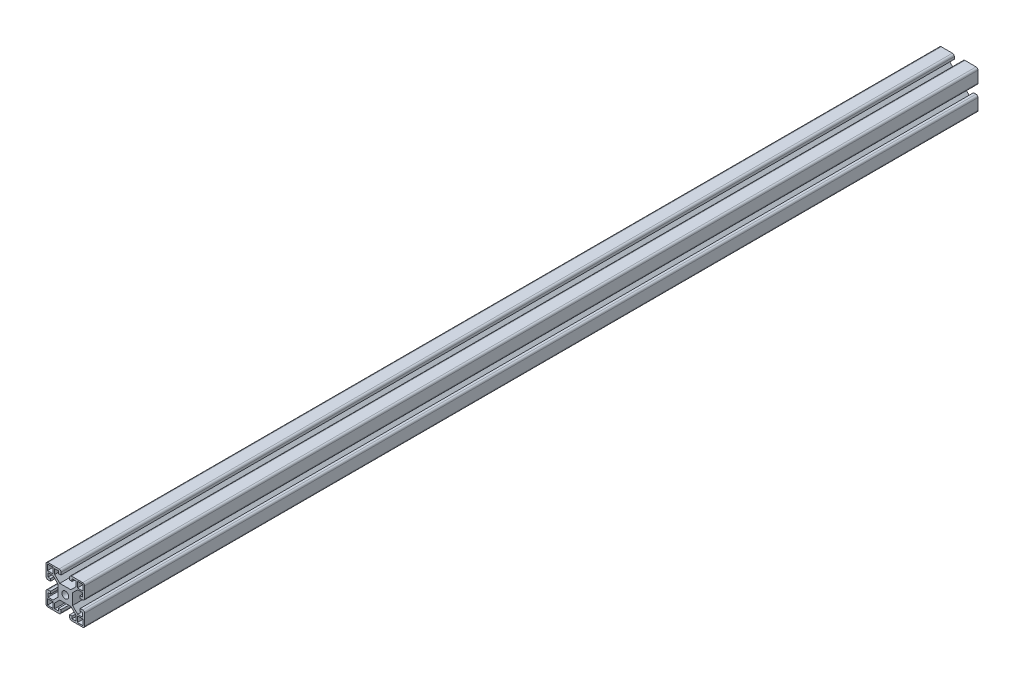
from build123d import *

# Parameters (mm, degrees)
CROQUIS1_W              = 40
CROQUIS1_H              = 40
SALIENTE_EXTRUIR1_DEPTH = 924.8
CROQUIS2_W              = 6
CROQUIS2_H              = 6
CROQUIS2_R              = 3.5
CORTAR_EXTRUIR2_DEPTH   = 924.8
REDONDEO1_R             = 2
REDONDEO2_R             = 2


with BuildPart() as part:
    # Croquis1 → Saliente-Extruir1 (new body)
    with BuildSketch(Plane.XY):
        Rectangle(CROQUIS1_W, CROQUIS1_H)
    extrude(amount=SALIENTE_EXTRUIR1_DEPTH)

    # Croquis2 → Cortar-Extruir2 (cut)
    with BuildSketch(Plane.XY.offset(924.8)):
        with Locations((-15.5, 15.5)):
            Rectangle(CROQUIS2_W, CROQUIS2_H)
        Polygon((4.5, 15.5), (4.5, 20), (-4.5, 20), (-4.5, 15.5), (-7, 15.5), (-7, 18), (-11, 18), (-11, 12.767766953), (-5.733637236, 7.501404189), (5.733637236, 7.501404189), (11, 12.767766953), (11, 18), (7, 18), (7, 15.5), align=None)
        with Locations((15.5, 15.5)):
            Rectangle(CROQUIS2_W, CROQUIS2_H)
        Polygon((15.367588592, -4.5), (20, -4.5), (20, 4.5), (15.367588592, 4.5), (15.367588592, 7), (17.867588592, 7), (17.867588592, 11), (12.767766953, 11), (7.501349817, 5.733582864), (7.501349817, -5.733582864), (12.767766953, -11), (17.867588592, -11), (17.867588592, -7), (15.367588592, -7), align=None)
        Polygon((-20, 4.5), (-20, -4.5), (-15.367588592, -4.5), (-15.367588592, -7), (-17.867588592, -7), (-17.867588592, -11), (-12.767766953, -11), (-7.501349817, -5.733582864), (-7.501349817, 5.733582864), (-12.767766953, 11), (-17.867588592, 11), (-17.867588592, 7), (-15.367588592, 7), (-15.367588592, 4.5), align=None)
        Circle(CROQUIS2_R)
        Polygon((11, -12.767766953), (5.733637236, -7.501404189), (-5.733637236, -7.501404189), (-11, -12.767766953), (-11, -18), (-7, -18), (-7, -15.5), (-4.5, -15.5), (-4.5, -20), (4.5, -20), (4.5, -15.5), (7, -15.5), (7, -18), (11, -18), align=None)
        with Locations((-15.5, -15.5)):
            Rectangle(CROQUIS2_W, CROQUIS2_H)
        with Locations((15.5, -15.5)):
            Rectangle(CROQUIS2_W, CROQUIS2_H)
    extrude(amount=-CORTAR_EXTRUIR2_DEPTH, mode=Mode.SUBTRACT)

    # Redondeo1
    redondeo1_edges = [part.edges().sort_by_distance(p)[0] for p in [
        (20, -20, 462.4),
        (-20, -20, 462.4),
        (-20, 20, 462.4),
        (20, 20, 462.4),
    ]]
    fillet(redondeo1_edges, radius=REDONDEO1_R)

    # Redondeo2
    redondeo2_edges = [part.edges().sort_by_distance(p)[0] for p in [
        (4.5, 20, 462.4),
        (-4.5, 20, 462.4),
        (20, -4.5, 462.4),
        (20, 4.5, 462.4),
        (-20, 4.5, 462.4),
        (-20, -4.5, 462.4),
        (-4.5, -20, 462.4),
        (4.5, -20, 462.4),
    ]]
    fillet(redondeo2_edges, radius=REDONDEO2_R)


solid = part.part
